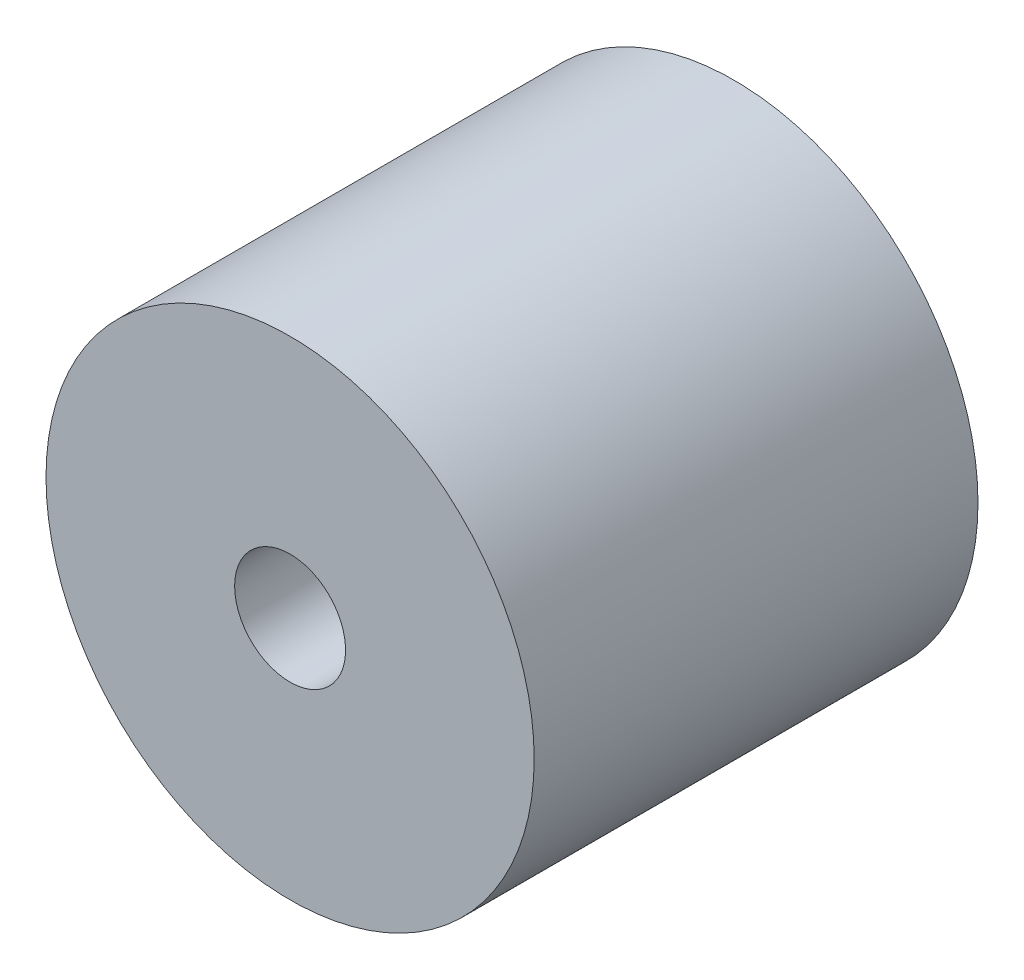
from build123d import *

# Parameters (mm, degrees)
SKETCH_1_R          = 11
EXTRUDE_1_DEPTH     = 20
SKETCH_3_R          = 2.5
CUT_EXTRUDE_2_DEPTH = 26.337718919


with BuildPart() as part:
    # 草图1 → 凸台-拉伸1 (new body)
    with BuildSketch(Plane.XY):
        Circle(SKETCH_1_R)
    extrude(amount=EXTRUDE_1_DEPTH)

    # 草图3 → 切除-拉伸2 (cut, through all)
    with BuildSketch(Plane(origin=(0, 0, 0), x_dir=(-1, 0, 0), z_dir=(0, 0, -1))):
        Circle(SKETCH_3_R)
    extrude(amount=-CUT_EXTRUDE_2_DEPTH, mode=Mode.SUBTRACT)


solid = part.part
